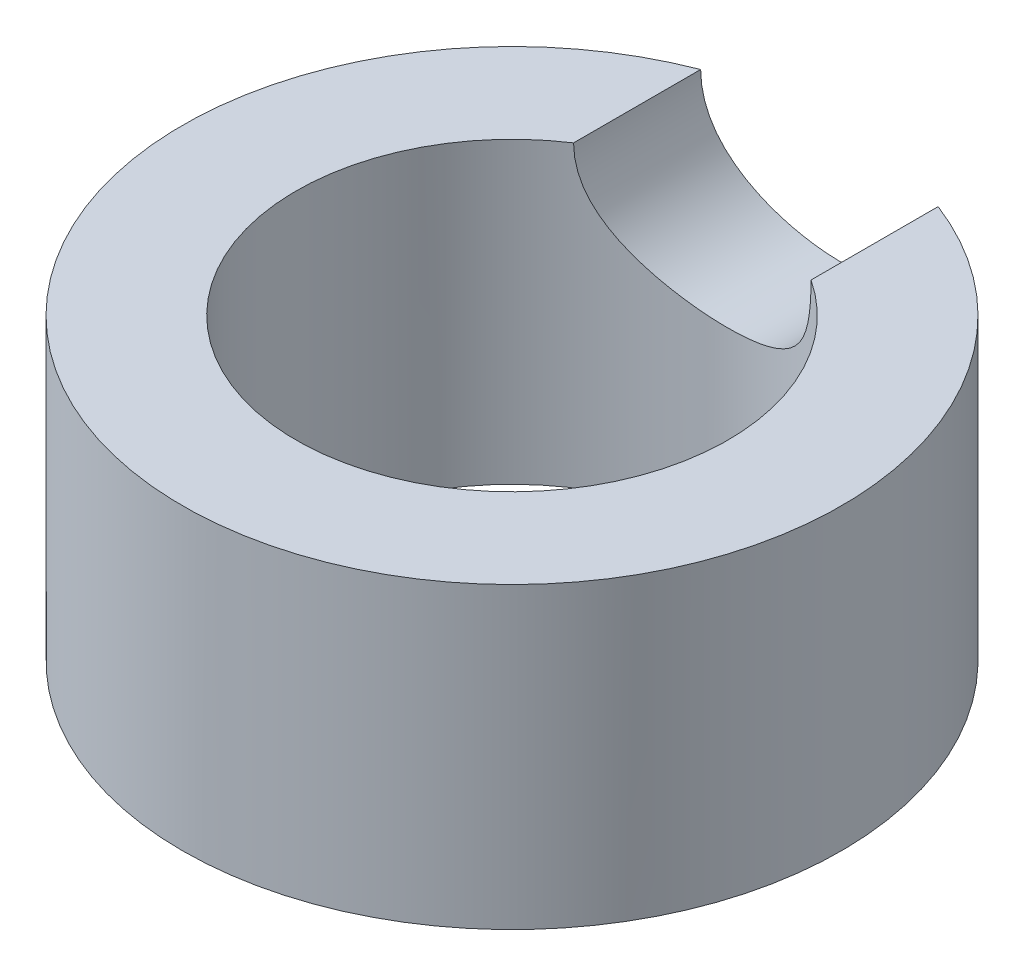
from build123d import *

# Parameters (mm, degrees)
SKETCH1_R           = 29
SKETCH1_R_2         = 19
BOSS_EXTRUDE1_DEPTH = 26.3
SKETCH2_R           = 10.45
CUT_EXTRUDE1_DEPTH  = 49.720529554


with BuildPart() as part:
    # Sketch1 → Boss-Extrude1 (new body)
    with BuildSketch(Plane(origin=(0, 0, 0), x_dir=(1, 0, 0), z_dir=(0, 1, 0))):
        with Locations(Location((0, 0, 0), (0, 0, 270))):
            Circle(SKETCH1_R)
        with Locations(Location((0, 0, 0), (0, 0, 270))):
            Circle(SKETCH1_R_2, mode=Mode.SUBTRACT)
    extrude(amount=BOSS_EXTRUDE1_DEPTH)

    # Sketch2 → Cut-Extrude1 (cut, through all)
    with BuildSketch(Plane.XY):
        with Locations((0, 26.3)):
            Circle(SKETCH2_R)
    extrude(amount=-CUT_EXTRUDE1_DEPTH, mode=Mode.SUBTRACT)


solid = part.part
